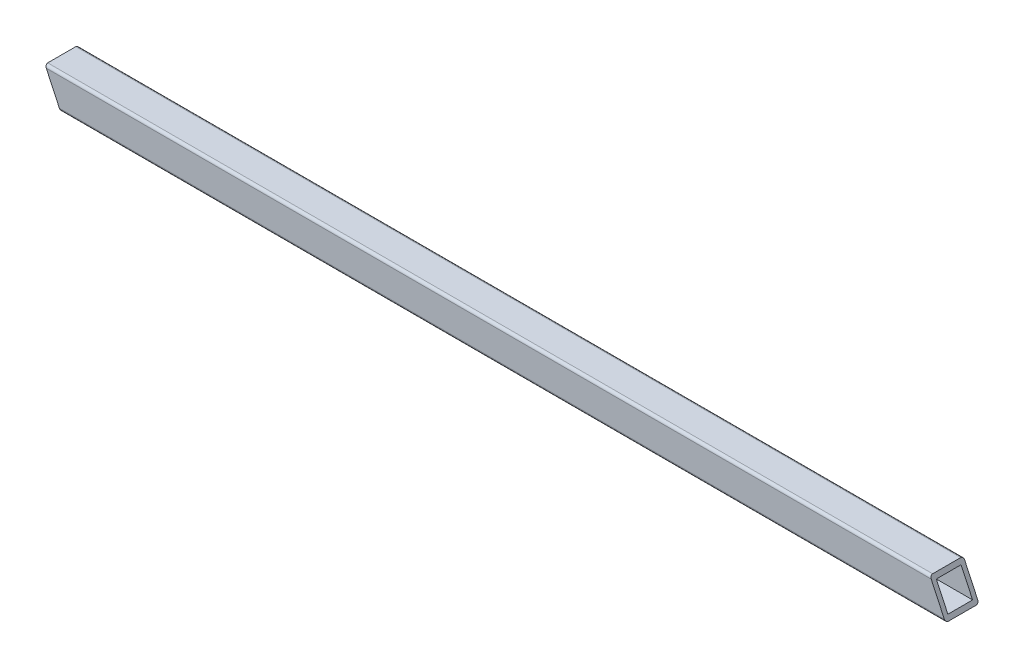
from build123d import *

# Parameters (mm, degrees)
SKETCH1_W           = 23.495
SKETCH1_H           = 23.495
BOSS_EXTRUDE1_DEPTH = 342.22874176
SCALE1_SCALE_X      = 1
SCALE1_SCALE_Y      = 0.4
SCALE1_SCALE_Z      = 0.4
CUT_EXTRUDE1_DEPTH  = 344.184720504


with BuildPart() as part:
    # Sketch1 → Boss-Extrude1 (new body)
    with BuildSketch(Plane(origin=(0, 0, 0), x_dir=(0, 0, -1), z_dir=(1, 0, 0))):
        with BuildLine():
            Line((0, 2.54), (0, 29.21))
            ThreePointArc((0, 29.21), (-0.743948776, 31.006051224), (-2.54, 31.75))
            Line((-2.54, 31.75), (-29.21, 31.75))
            ThreePointArc((-29.21, 31.75), (-31.006051224, 31.006051224), (-31.75, 29.21))
            Line((-31.75, 29.21), (-31.75, 2.54))
            ThreePointArc((-31.75, 2.54), (-31.006051224, 0.743948776), (-29.21, 0))
            Line((-29.21, 0), (-2.54, 0))
            ThreePointArc((-2.54, 0), (-0.743948776, 0.743948776), (0, 2.54))
        make_face()
        with Locations((-15.875, 15.875)):
            Rectangle(SKETCH1_W, SKETCH1_H, mode=Mode.SUBTRACT)
    extrude(amount=BOSS_EXTRUDE1_DEPTH)


with BuildPart() as part_1:
    # Scale1: scaled about (171.11437088, 15.875, 15.875)
    add(part.part.scale((SCALE1_SCALE_X, SCALE1_SCALE_Y, SCALE1_SCALE_Z), about=(171.11437088, 15.875, 15.875)))

    # Sketch2 → Cut-Extrude1 (cut, through all)
    with BuildSketch(Plane.XY.offset(22.225)):
        Polygon((342.22874176, 9.525), (336.306634502, 22.225), (342.22874176, 22.225), align=None)
        Polygon((0, 9.525), (0, 22.225), (5.922107259, 9.525), align=None)
    extrude(amount=-CUT_EXTRUDE1_DEPTH, mode=Mode.SUBTRACT)


solid = part_1.part
